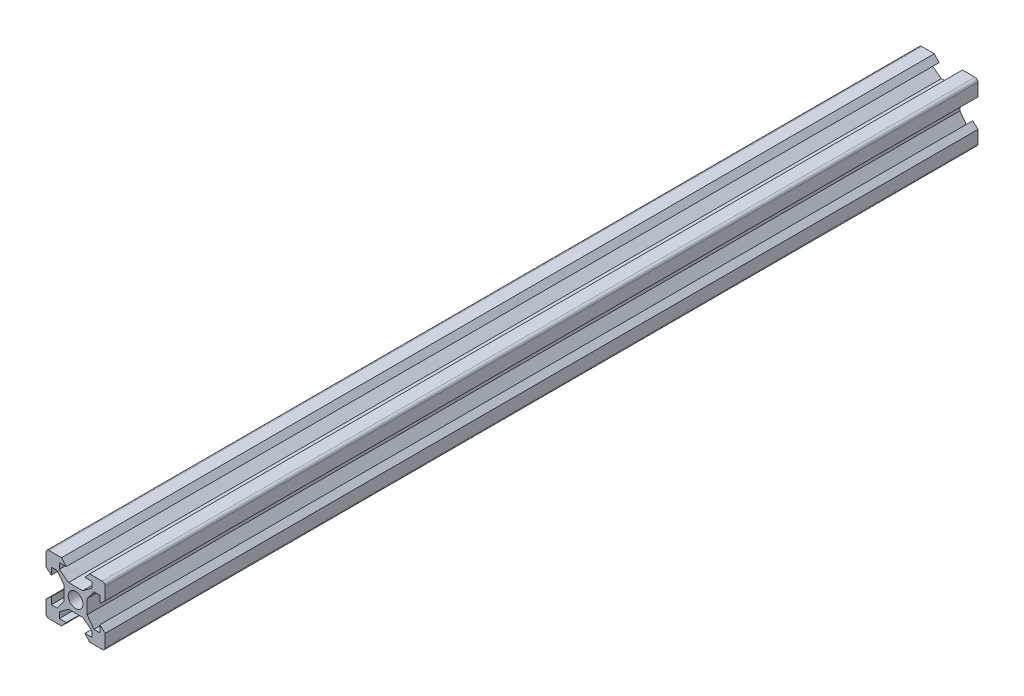
from build123d import *

# Parameters (mm, degrees)
SKETCH1_R           = 2.5
BOSS_EXTRUDE1_DEPTH = 295


with BuildPart() as part:
    # Sketch1 → Boss-Extrude1 (new body)
    with BuildSketch(Plane.XY):
        with BuildLine():
            Line((-5.5, 8.2), (-3.15, 8.2))
            Line((-3.15, 8.2), (-4.75, 10))
            Line((-4.75, 10), (-9, 10))
            ThreePointArc((-9, 10), (-9.707106781, 9.707106781), (-10, 9))
            Line((-10, 9), (-10, 4.75))
            Line((-10, 4.75), (-8.2, 3.15))
            Line((-8.2, 3.15), (-8.2, 5.5))
            Line((-8.2, 5.5), (-6.2, 5.5))
            Line((-6.2, 5.5), (-3.9, 2.387933369))
            Line((-3.9, 2.387933369), (-3.9, -2.387933369))
            Line((-3.9, -2.387933369), (-6.2, -5.5))
            Line((-6.2, -5.5), (-8.2, -5.5))
            Line((-8.2, -5.5), (-8.2, -3.15))
            Line((-8.2, -3.15), (-10, -4.75))
            Line((-10, -4.75), (-10, -9))
            ThreePointArc((-10, -9), (-9.707106781, -9.707106781), (-9, -10))
            Line((-9, -10), (-4.75, -10))
            Line((-4.75, -10), (-3.15, -8.2))
            Line((-3.15, -8.2), (-5.5, -8.2))
            Line((-5.5, -8.2), (-5.5, -6.2))
            Line((-5.5, -6.2), (-2.387933369, -3.9))
            Line((-2.387933369, -3.9), (2.387933369, -3.9))
            Line((2.387933369, -3.9), (5.5, -6.2))
            Line((5.5, -6.2), (5.5, -8.2))
            Line((5.5, -8.2), (3.15, -8.2))
            Line((3.15, -8.2), (4.75, -10))
            Line((4.75, -10), (9, -10))
            ThreePointArc((9, -10), (9.707106781, -9.707106781), (10, -9))
            Line((10, -9), (10, -4.75))
            Line((10, -4.75), (8.2, -3.15))
            Line((8.2, -3.15), (8.2, -5.5))
            Line((8.2, -5.5), (6.2, -5.5))
            Line((6.2, -5.5), (3.9, -2.387933369))
            Line((3.9, -2.387933369), (3.9, 2.387933369))
            Line((3.9, 2.387933369), (6.2, 5.5))
            Line((6.2, 5.5), (8.2, 5.5))
            Line((8.2, 5.5), (8.2, 3.15))
            Line((8.2, 3.15), (10, 4.75))
            Line((10, 4.75), (10, 9))
            ThreePointArc((10, 9), (9.707106781, 9.707106781), (9, 10))
            Line((9, 10), (4.75, 10))
            Line((4.75, 10), (3.15, 8.2))
            Line((3.15, 8.2), (5.5, 8.2))
            Line((5.5, 8.2), (5.5, 6.2))
            Line((5.5, 6.2), (2.387933369, 3.9))
            Line((2.387933369, 3.9), (-2.387933369, 3.9))
            Line((-2.387933369, 3.9), (-5.5, 6.2))
            Line((-5.5, 6.2), (-5.5, 8.2))
        make_face()
        Circle(SKETCH1_R, mode=Mode.SUBTRACT)
    extrude(amount=BOSS_EXTRUDE1_DEPTH)


solid = part.part
